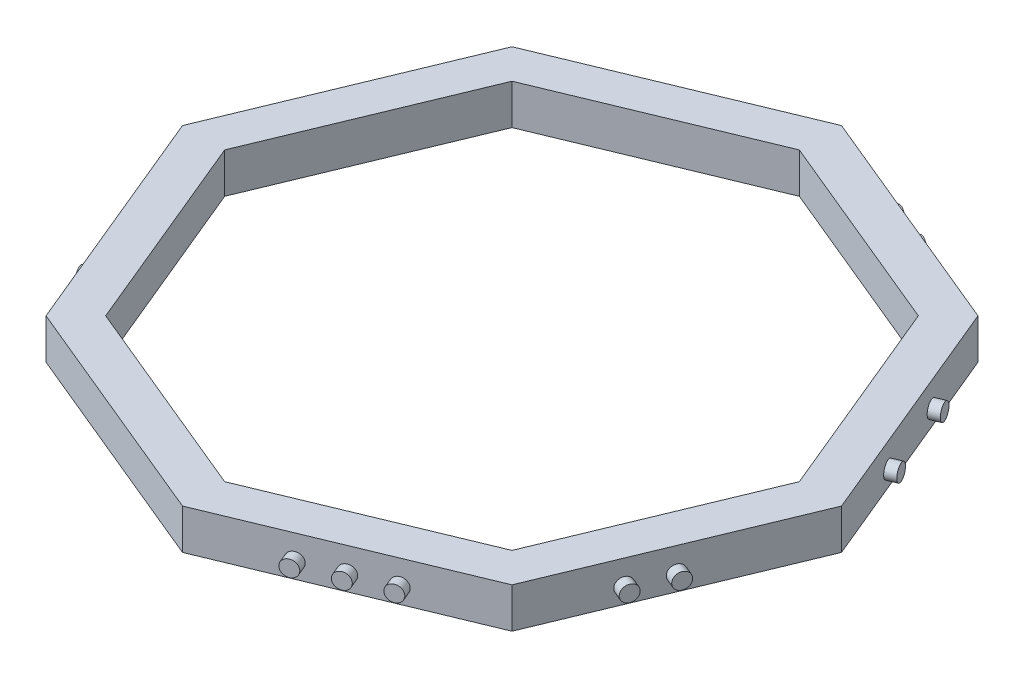
from build123d import *

# Parameters (mm, degrees)
BOSS_EXTRUDE1_DEPTH  = 5
CUT_EXTRUDE1_DEPTH   = 5
SKETCH6_R            = 1
BOSS_EXTRUDE5_DEPTH  = 1.25
SKETCH7_R            = 1
BOSS_EXTRUDE6_DEPTH  = 1.25
SKETCH8_R            = 1
BOSS_EXTRUDE7_DEPTH  = 1.25
BOSS_EXTRUDE8_START  = 1.25
SKETCH9_R            = 1
BOSS_EXTRUDE8_DEPTH  = 1.25
SKETCH10_R           = 1
BOSS_EXTRUDE9_DEPTH  = 1.25
BOSS_EXTRUDE10_START = 1.25
SKETCH11_R           = 1
BOSS_EXTRUDE10_DEPTH = 1.25
BOSS_EXTRUDE11_START = 1.25
SKETCH12_R           = 1
BOSS_EXTRUDE11_DEPTH = 1.25


with BuildPart() as part:
    # Sketch3 → Boss-Extrude1 (new body)
    with BuildSketch(Plane(origin=(0, 0, 0), x_dir=(1, 0, 0), z_dir=(0, 1, 0))):
        Polygon((41, 0), (28.991378029, 28.991378029), (0, 41), (-28.991378029, 28.991378029), (-41, 0), (-28.991378029, -28.991378029), (0, -41), (28.991378029, -28.991378029), align=None)
    extrude(amount=BOSS_EXTRUDE1_DEPTH)

    # Sketch5 → Cut-Extrude1 (cut)
    with BuildSketch(Plane(origin=(0, 5, 0), x_dir=(1, 0, 0), z_dir=(0, 1, 0))):
        Polygon((35.75, 0), (25.279067427, 25.279067427), (0, 35.75), (-25.279067427, 25.279067427), (-35.75, 0), (-25.279067427, -25.279067427), (0, -35.75), (25.279067427, -25.279067427), align=None)
    extrude(amount=-CUT_EXTRUDE1_DEPTH, mode=Mode.SUBTRACT)

    # Sketch6 → Boss-Extrude5 (add)
    with BuildSketch(Plane(origin=(14.495689014, 0, 34.995689014), x_dir=(0.9238795325112827, 0, -0.38268343236509966), z_dir=(0.38268343236509966, 0, 0.9238795325112827))):
        with Locations(Location((0, 2, 0), (0, 0, 180))):
            Circle(SKETCH6_R)
        with Locations(Location((-5, 2, 0), (0, 0, 180))):
            Circle(SKETCH6_R)
        with Locations(Location((5, 2, 0), (0, 0, 180))):
            Circle(SKETCH6_R)
    extrude(amount=BOSS_EXTRUDE5_DEPTH)

    # Sketch7 → Boss-Extrude6 (add)
    with BuildSketch(Plane(origin=(-34.995689014, 0, 14.495689014), x_dir=(0.3826834323650997, 0, 0.9238795325112827), z_dir=(-0.9238795325112827, 0, 0.3826834323650997))):
        with Locations(Location((5, 2, 0), (0, 0, 180))):
            Circle(SKETCH7_R)
    extrude(amount=BOSS_EXTRUDE6_DEPTH)

    # Sketch8 → Boss-Extrude7 (add)
    with BuildSketch(Plane(origin=(-34.995689014, 0, -14.495689014), x_dir=(-0.3826834323650795, 0, 0.9238795325112911), z_dir=(-0.9238795325112911, 0, -0.3826834323650795))):
        with Locations(Location((0, 2, 0), (0, 0, 180))):
            Circle(SKETCH8_R)
    extrude(amount=BOSS_EXTRUDE7_DEPTH)

    # Sketch9 → Boss-Extrude8 (add)
    with BuildSketch(Plane(origin=(-14.495689014, 0, -34.995689014), x_dir=(-0.9238795325112826, 0, 0.38268343236509983), z_dir=(-0.38268343236509983, 0, -0.9238795325112826)).offset(BOSS_EXTRUDE8_START)):
        with Locations((-5, 2)):
            Circle(SKETCH9_R)
    extrude(amount=-BOSS_EXTRUDE8_DEPTH)

    # Sketch10 → Boss-Extrude9 (add)
    with BuildSketch(Plane(origin=(14.495689014, 0, -34.995689014), x_dir=(-0.923879532511291, 0, -0.38268343236507973), z_dir=(0.38268343236507973, 0, -0.923879532511291))):
        with Locations(Location((0, 2, 0), (0, 0, 180))):
            Circle(SKETCH10_R)
        with Locations(Location((5, 2, 0), (0, 0, 180))):
            Circle(SKETCH10_R)
    extrude(amount=BOSS_EXTRUDE9_DEPTH)

    # Sketch11 → Boss-Extrude10 (add)
    with BuildSketch(Plane(origin=(34.995689014, 0, -14.495689014), x_dir=(-0.3826834323651001, 0, -0.9238795325112825), z_dir=(0.9238795325112824, 0, -0.38268343236510005)).offset(BOSS_EXTRUDE10_START)):
        with Locations(Location((5, 2, 0), (0, 0, 180))):
            Circle(SKETCH11_R)
        with Locations((-5, 2)):
            Circle(SKETCH11_R)
    extrude(amount=-BOSS_EXTRUDE10_DEPTH)

    # Sketch12 → Boss-Extrude11 (add)
    with BuildSketch(Plane(origin=(34.995689014, 0, 14.495689014), x_dir=(0.3826834323650795, 0, -0.923879532511291), z_dir=(0.9238795325112911, 0, 0.38268343236507957)).offset(BOSS_EXTRUDE11_START)):
        with Locations((0, 2)):
            Circle(SKETCH12_R)
        with Locations(Location((-5, 2, 0), (0, 0, 180))):
            Circle(SKETCH12_R)
    extrude(amount=-BOSS_EXTRUDE11_DEPTH)


solid = part.part
